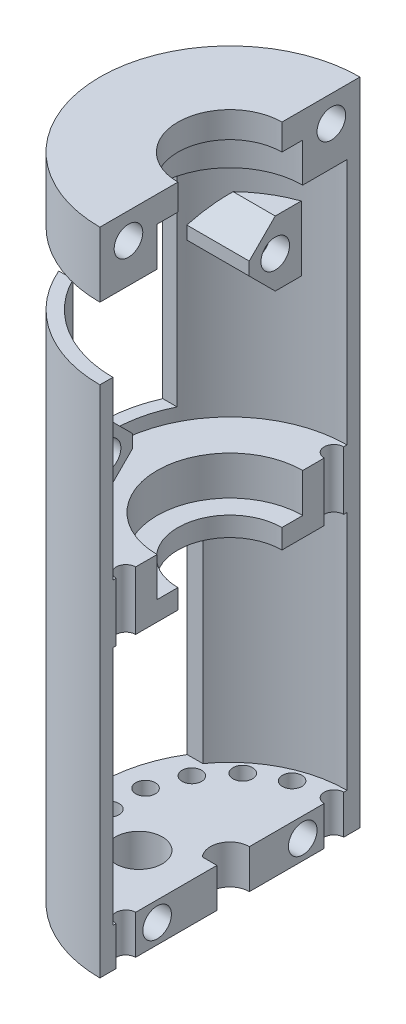
from build123d import *

# Parameters (mm, degrees)
SKETCH_1_R               = 10
EXTRUDE_1_DEPTH          = 3
CUT_EXTRUDE_1_REACH      = 16.457
SKETCH_2_R               = 0.75
SKETCH_3_R               = 10
SKETCH_3_R_2             = 9
EXTRUDE_2_DEPTH          = 47
CUT_EXTRUDE_START        = -50
CUT_EXTRUDE_2_DEPTH      = 50
EXTRUDE_3_DEPTH          = 5
SKETCH_6_R               = 1.1
CUT_EXTRUDE_3_DEPTH      = 1.5
EXTRUDE_START            = -5
EXTRUDE_4_DEPTH          = 5
SKETCH_8_R               = 1.1
CUT_EXTRUDE_4_DEPTH      = 1.5
EXTRUDE_START_2          = -23
EXTRUDE_5_DEPTH          = 3
EXTRUDE_START_3          = 1.5
EXTRUDE_6_DEPTH          = 1.5
EXTRUDE_START_4          = -2
EXTRUDE_7_DEPTH          = 2
EXTRUDE_START_5          = 3
EXTRUDE_8_DEPTH          = 3
CUT_EXTRUDE_5_REACH      = 31.597
SKETCH_13_R              = 0.75
CUT_EXTRUDE_6_REACH      = 53.962
CUT_EXTRUDE_6_END_RADIUS = 10
SKETCH_14_W              = 10.500045379
SKETCH_14_H              = 18.5
CUT_EXTRUDE_7_REACH      = 53.962
CUT_EXTRUDE_7_END_RADIUS = 10
SKETCH_16_R              = 1.1
CUT_EXTRUDE_8_DEPTH      = 3
CHAMFER_1_SIZE           = 2
CUT_EXTRUDE1_REACH       = 51.082
SKETCH1_R                = 1.8


with BuildPart() as part:
    # 草图1 → 凸台-拉伸1 (new body)
    with BuildSketch(Plane(origin=(0, 0, 0), x_dir=(1, 0, 0), z_dir=(0, 1, 0))):
        with Locations(Location((0, 0, 0), (0, 0, 270))):
            Circle(SKETCH_1_R)
        with BuildLine():
            Line((-1.118033989, -1), (1.118033989, -1))
            ThreePointArc((1.118033989, -1), (0, 1.5), (-1.118033989, -1))
        make_face(mode=Mode.SUBTRACT)
    extrude(amount=EXTRUDE_1_DEPTH)

    # 草图2 → 切除-拉伸1 (cut, up to next)
    with BuildSketch(Plane(origin=(0, 3, 0), x_dir=(1, 0, 0), z_dir=(0, 1, 0)), mode=Mode.PRIVATE) as cut_extrude_1_sk1:
        with Locations(Location((0, 8, 0), (0, 0, 270))):
            Circle(SKETCH_2_R)
    cut_extrude_1_tool1 = extrude(cut_extrude_1_sk1.sketch, amount=-CUT_EXTRUDE_1_REACH, mode=Mode.PRIVATE) & part.part
    # 草图2 → 切除-拉伸1 (cut, up to next)
    with BuildSketch(Plane(origin=(0, 3, 0), x_dir=(1, 0, 0), z_dir=(0, 1, 0)), mode=Mode.PRIVATE) as cut_extrude_1_sk2:
        with Locations(Location((2.736161147, 7.517540966, 0), (0, 0, 270))):
            Circle(SKETCH_2_R)
    cut_extrude_1_tool2 = extrude(cut_extrude_1_sk2.sketch, amount=-CUT_EXTRUDE_1_REACH, mode=Mode.PRIVATE) & part.part
    # 草图2 → 切除-拉伸1 (cut, up to next)
    with BuildSketch(Plane(origin=(0, 3, 0), x_dir=(1, 0, 0), z_dir=(0, 1, 0)), mode=Mode.PRIVATE) as cut_extrude_1_sk3:
        with Locations(Location((5.142300877, 6.128355545, 0), (0, 0, 270))):
            Circle(SKETCH_2_R)
    cut_extrude_1_tool3 = extrude(cut_extrude_1_sk3.sketch, amount=-CUT_EXTRUDE_1_REACH, mode=Mode.PRIVATE) & part.part
    # 草图2 → 切除-拉伸1 (cut, up to next)
    with BuildSketch(Plane(origin=(0, 3, 0), x_dir=(1, 0, 0), z_dir=(0, 1, 0)), mode=Mode.PRIVATE) as cut_extrude_1_sk4:
        with Locations(Location((6.92820323, 4, 0), (0, 0, 270))):
            Circle(SKETCH_2_R)
    cut_extrude_1_tool4 = extrude(cut_extrude_1_sk4.sketch, amount=-CUT_EXTRUDE_1_REACH, mode=Mode.PRIVATE) & part.part
    # 草图2 → 切除-拉伸1 (cut, up to next)
    with BuildSketch(Plane(origin=(0, 3, 0), x_dir=(1, 0, 0), z_dir=(0, 1, 0)), mode=Mode.PRIVATE) as cut_extrude_1_sk5:
        with Locations(Location((7.878462024, 1.389185421, 0), (0, 0, 270))):
            Circle(SKETCH_2_R)
    cut_extrude_1_tool5 = extrude(cut_extrude_1_sk5.sketch, amount=-CUT_EXTRUDE_1_REACH, mode=Mode.PRIVATE) & part.part
    # 草图2 → 切除-拉伸1 (cut, up to next)
    with BuildSketch(Plane(origin=(0, 3, 0), x_dir=(1, 0, 0), z_dir=(0, 1, 0)), mode=Mode.PRIVATE) as cut_extrude_1_sk6:
        with Locations(Location((7.878462024, -1.389185421, 0), (0, 0, 270))):
            Circle(SKETCH_2_R)
    cut_extrude_1_tool6 = extrude(cut_extrude_1_sk6.sketch, amount=-CUT_EXTRUDE_1_REACH, mode=Mode.PRIVATE) & part.part
    # 草图2 → 切除-拉伸1 (cut, up to next)
    with BuildSketch(Plane(origin=(0, 3, 0), x_dir=(1, 0, 0), z_dir=(0, 1, 0)), mode=Mode.PRIVATE) as cut_extrude_1_sk7:
        with Locations(Location((6.92820323, -4, 0), (0, 0, 270))):
            Circle(SKETCH_2_R)
    cut_extrude_1_tool7 = extrude(cut_extrude_1_sk7.sketch, amount=-CUT_EXTRUDE_1_REACH, mode=Mode.PRIVATE) & part.part
    # 草图2 → 切除-拉伸1 (cut, up to next)
    with BuildSketch(Plane(origin=(0, 3, 0), x_dir=(1, 0, 0), z_dir=(0, 1, 0)), mode=Mode.PRIVATE) as cut_extrude_1_sk8:
        with Locations(Location((5.142300877, -6.128355545, 0), (0, 0, 270))):
            Circle(SKETCH_2_R)
    cut_extrude_1_tool8 = extrude(cut_extrude_1_sk8.sketch, amount=-CUT_EXTRUDE_1_REACH, mode=Mode.PRIVATE) & part.part
    # 草图2 → 切除-拉伸1 (cut, up to next)
    with BuildSketch(Plane(origin=(0, 3, 0), x_dir=(1, 0, 0), z_dir=(0, 1, 0)), mode=Mode.PRIVATE) as cut_extrude_1_sk9:
        with Locations(Location((2.736161147, -7.517540966, 0), (0, 0, 270))):
            Circle(SKETCH_2_R)
    cut_extrude_1_tool9 = extrude(cut_extrude_1_sk9.sketch, amount=-CUT_EXTRUDE_1_REACH, mode=Mode.PRIVATE) & part.part
    # 草图2 → 切除-拉伸1 (cut, up to next)
    with BuildSketch(Plane(origin=(0, 3, 0), x_dir=(1, 0, 0), z_dir=(0, 1, 0)), mode=Mode.PRIVATE) as cut_extrude_1_sk10:
        with Locations(Location((0, -8, 0), (0, 0, 270))):
            Circle(SKETCH_2_R)
    cut_extrude_1_tool10 = extrude(cut_extrude_1_sk10.sketch, amount=-CUT_EXTRUDE_1_REACH, mode=Mode.PRIVATE) & part.part
    # 草图2 → 切除-拉伸1 (cut, up to next)
    with BuildSketch(Plane(origin=(0, 3, 0), x_dir=(1, 0, 0), z_dir=(0, 1, 0)), mode=Mode.PRIVATE) as cut_extrude_1_sk11:
        with Locations(Location((-2.736161147, -7.517540966, 0), (0, 0, 270))):
            Circle(SKETCH_2_R)
    cut_extrude_1_tool11 = extrude(cut_extrude_1_sk11.sketch, amount=-CUT_EXTRUDE_1_REACH, mode=Mode.PRIVATE) & part.part
    # 草图2 → 切除-拉伸1 (cut, up to next)
    with BuildSketch(Plane(origin=(0, 3, 0), x_dir=(1, 0, 0), z_dir=(0, 1, 0)), mode=Mode.PRIVATE) as cut_extrude_1_sk12:
        with Locations(Location((-5.142300877, -6.128355545, 0), (0, 0, 270))):
            Circle(SKETCH_2_R)
    cut_extrude_1_tool12 = extrude(cut_extrude_1_sk12.sketch, amount=-CUT_EXTRUDE_1_REACH, mode=Mode.PRIVATE) & part.part
    # 草图2 → 切除-拉伸1 (cut, up to next)
    with BuildSketch(Plane(origin=(0, 3, 0), x_dir=(1, 0, 0), z_dir=(0, 1, 0)), mode=Mode.PRIVATE) as cut_extrude_1_sk13:
        with Locations(Location((-6.92820323, -4, 0), (0, 0, 270))):
            Circle(SKETCH_2_R)
    cut_extrude_1_tool13 = extrude(cut_extrude_1_sk13.sketch, amount=-CUT_EXTRUDE_1_REACH, mode=Mode.PRIVATE) & part.part
    # 草图2 → 切除-拉伸1 (cut, up to next)
    with BuildSketch(Plane(origin=(0, 3, 0), x_dir=(1, 0, 0), z_dir=(0, 1, 0)), mode=Mode.PRIVATE) as cut_extrude_1_sk14:
        with Locations(Location((-7.878462024, -1.389185421, 0), (0, 0, 270))):
            Circle(SKETCH_2_R)
    cut_extrude_1_tool14 = extrude(cut_extrude_1_sk14.sketch, amount=-CUT_EXTRUDE_1_REACH, mode=Mode.PRIVATE) & part.part
    # 草图2 → 切除-拉伸1 (cut, up to next)
    with BuildSketch(Plane(origin=(0, 3, 0), x_dir=(1, 0, 0), z_dir=(0, 1, 0)), mode=Mode.PRIVATE) as cut_extrude_1_sk15:
        with Locations(Location((-7.878462024, 1.389185421, 0), (0, 0, 270))):
            Circle(SKETCH_2_R)
    cut_extrude_1_tool15 = extrude(cut_extrude_1_sk15.sketch, amount=-CUT_EXTRUDE_1_REACH, mode=Mode.PRIVATE) & part.part
    # 草图2 → 切除-拉伸1 (cut, up to next)
    with BuildSketch(Plane(origin=(0, 3, 0), x_dir=(1, 0, 0), z_dir=(0, 1, 0)), mode=Mode.PRIVATE) as cut_extrude_1_sk16:
        with Locations(Location((-6.92820323, 4, 0), (0, 0, 270))):
            Circle(SKETCH_2_R)
    cut_extrude_1_tool16 = extrude(cut_extrude_1_sk16.sketch, amount=-CUT_EXTRUDE_1_REACH, mode=Mode.PRIVATE) & part.part
    # 草图2 → 切除-拉伸1 (cut, up to next)
    with BuildSketch(Plane(origin=(0, 3, 0), x_dir=(1, 0, 0), z_dir=(0, 1, 0)), mode=Mode.PRIVATE) as cut_extrude_1_sk17:
        with Locations(Location((-5.142300877, 6.128355545, 0), (0, 0, 270))):
            Circle(SKETCH_2_R)
    cut_extrude_1_tool17 = extrude(cut_extrude_1_sk17.sketch, amount=-CUT_EXTRUDE_1_REACH, mode=Mode.PRIVATE) & part.part
    # 草图2 → 切除-拉伸1 (cut, up to next)
    with BuildSketch(Plane(origin=(0, 3, 0), x_dir=(1, 0, 0), z_dir=(0, 1, 0)), mode=Mode.PRIVATE) as cut_extrude_1_sk18:
        with Locations(Location((-2.736161147, 7.517540966, 0), (0, 0, 270))):
            Circle(SKETCH_2_R)
    cut_extrude_1_tool18 = extrude(cut_extrude_1_sk18.sketch, amount=-CUT_EXTRUDE_1_REACH, mode=Mode.PRIVATE) & part.part
    add(cut_extrude_1_tool1.solids().sort_by_distance((0, 3, -8))[0], mode=Mode.SUBTRACT)
    add(cut_extrude_1_tool2.solids().sort_by_distance((2.736161, 3, -7.517541))[0], mode=Mode.SUBTRACT)
    add(cut_extrude_1_tool3.solids().sort_by_distance((5.142301, 3, -6.128356))[0], mode=Mode.SUBTRACT)
    add(cut_extrude_1_tool4.solids().sort_by_distance((6.928203, 3, -4))[0], mode=Mode.SUBTRACT)
    add(cut_extrude_1_tool5.solids().sort_by_distance((7.878462, 3, -1.389185))[0], mode=Mode.SUBTRACT)
    add(cut_extrude_1_tool6.solids().sort_by_distance((7.878462, 3, 1.389185))[0], mode=Mode.SUBTRACT)
    add(cut_extrude_1_tool7.solids().sort_by_distance((6.928203, 3, 4))[0], mode=Mode.SUBTRACT)
    add(cut_extrude_1_tool8.solids().sort_by_distance((5.142301, 3, 6.128356))[0], mode=Mode.SUBTRACT)
    add(cut_extrude_1_tool9.solids().sort_by_distance((2.736161, 3, 7.517541))[0], mode=Mode.SUBTRACT)
    add(cut_extrude_1_tool10.solids().sort_by_distance((0, 3, 8))[0], mode=Mode.SUBTRACT)
    add(cut_extrude_1_tool11.solids().sort_by_distance((-2.736161, 3, 7.517541))[0], mode=Mode.SUBTRACT)
    add(cut_extrude_1_tool12.solids().sort_by_distance((-5.142301, 3, 6.128356))[0], mode=Mode.SUBTRACT)
    add(cut_extrude_1_tool13.solids().sort_by_distance((-6.928203, 3, 4))[0], mode=Mode.SUBTRACT)
    add(cut_extrude_1_tool14.solids().sort_by_distance((-7.878462, 3, 1.389185))[0], mode=Mode.SUBTRACT)
    add(cut_extrude_1_tool15.solids().sort_by_distance((-7.878462, 3, -1.389185))[0], mode=Mode.SUBTRACT)
    add(cut_extrude_1_tool16.solids().sort_by_distance((-6.928203, 3, -4))[0], mode=Mode.SUBTRACT)
    add(cut_extrude_1_tool17.solids().sort_by_distance((-5.142301, 3, -6.128356))[0], mode=Mode.SUBTRACT)
    add(cut_extrude_1_tool18.solids().sort_by_distance((-2.736161, 3, -7.517541))[0], mode=Mode.SUBTRACT)

    # 草图3 → 凸台-拉伸2 (add)
    with BuildSketch(Plane(origin=(0, 3, 0), x_dir=(1, 0, 0), z_dir=(0, 1, 0))):
        with Locations(Location((0, 0, 0), (0, 0, 270))):
            Circle(SKETCH_3_R)
        with Locations(Location((0, 0, 0), (0, 0, 270))):
            Circle(SKETCH_3_R_2, mode=Mode.SUBTRACT)
    extrude(amount=EXTRUDE_2_DEPTH)

    # 草图4 → 切除-拉伸2 (cut)
    with BuildSketch(Plane(origin=(0, 50, 0), x_dir=(1, 0, 0), z_dir=(0, 1, 0)).offset(CUT_EXTRUDE_START)):
        with BuildLine():
            Line((0, -10), (0, 10))
            ThreePointArc((0, 10), (10, 0), (0, -10))
        make_face()
    extrude(amount=CUT_EXTRUDE_2_DEPTH, mode=Mode.SUBTRACT)

    # 草图5 → 凸台-拉伸3 (add)
    with BuildSketch(Plane(origin=(0, 29, 0), x_dir=(1, 0, 0), z_dir=(0, 1, 0))):
        with BuildLine():
            Line((-3, -8.485281374), (-3, -4.485281374))
            Line((-3, -4.485281374), (-7.802707927, -4.485281374))
            ThreePointArc((-7.802707927, -4.485281374), (-5.759741716, -6.9155893), (-3, -8.485281374))
        make_face()
    extrude(amount=EXTRUDE_3_DEPTH)

    # 草图6 → 切除-拉伸3 (cut)
    with BuildSketch(Plane(origin=(-3, 0, 0), x_dir=(0, 0, -1), z_dir=(1, 0, 0))):
        with Locations((-6.485281374, 31.5)):
            Circle(SKETCH_6_R)
    extrude(amount=-CUT_EXTRUDE_3_DEPTH, mode=Mode.SUBTRACT)

    # 草图7 → 凸台-拉伸4 (add)
    with BuildSketch(Plane(origin=(0, 41, 0), x_dir=(1, 0, 0), z_dir=(0, 1, 0)).offset(EXTRUDE_START)):
        with BuildLine():
            Line((-3, 8.485281374), (-3, 4.485281374))
            Line((-3, 4.485281374), (-7.802707927, 4.485281374))
            ThreePointArc((-7.802707927, 4.485281374), (-5.759741716, 6.9155893), (-3, 8.485281374))
        make_face()
    extrude(amount=EXTRUDE_4_DEPTH)

    # 草图8 → 切除-拉伸4 (cut)
    with BuildSketch(Plane(origin=(-3, 0, 0), x_dir=(0, 0, -1), z_dir=(1, 0, 0))):
        with Locations((6.485281374, 38.5)):
            Circle(SKETCH_8_R)
    extrude(amount=-CUT_EXTRUDE_4_DEPTH, mode=Mode.SUBTRACT)

    # 草图9 → 凸台-拉伸5 (add)
    with BuildSketch(Plane.XZ.offset(EXTRUDE_START_2)):
        with BuildLine():
            Line((0, 9), (0, 5.6))
            ThreePointArc((0, 5.6), (-5.6, 0), (0, -5.6))
            Line((0, -5.6), (0, -9))
            ThreePointArc((0, -9), (-9, 0), (0, 9))
        make_face()
    extrude(amount=-EXTRUDE_5_DEPTH)

    # 草图10 → 凸台-拉伸6 (add)
    with BuildSketch(Plane.XZ.offset(-23).offset(EXTRUDE_START_3)):
        with BuildLine():
            Line((0, 9), (0, 4))
            ThreePointArc((0, 4), (-4, 0), (0, -4))
            Line((0, -4), (0, -9))
            ThreePointArc((0, -9), (-9, 0), (0, 9))
        make_face()
    extrude(amount=-EXTRUDE_6_DEPTH)

    # 草图11 → 凸台-拉伸7 (add)
    with BuildSketch(Plane(origin=(0, 50, 0), x_dir=(1, 0, 0), z_dir=(0, 1, 0)).offset(EXTRUDE_START_4)):
        with BuildLine():
            Line((0, -9), (0, -4))
            ThreePointArc((0, -4), (-4, 0), (0, 4))
            Line((0, 4), (0, 9))
            ThreePointArc((0, 9), (-9, 0), (0, -9))
        make_face()
    extrude(amount=EXTRUDE_7_DEPTH)

    # 草图12 → 凸台-拉伸8 (add)
    with BuildSketch(Plane.XZ.offset(-48).offset(EXTRUDE_START_5)):
        with BuildLine():
            Line((0, 9), (0, 5.6))
            ThreePointArc((0, 5.6), (-5.6, 0), (0, -5.6))
            Line((0, -5.6), (0, -9))
            ThreePointArc((0, -9), (-9, 0), (0, 9))
        make_face()
    extrude(amount=-EXTRUDE_8_DEPTH)

    # 草图13 → 切除-拉伸5 (cut, up to next)
    with BuildSketch(Plane(origin=(0, 26, 0), x_dir=(1, 0, 0), z_dir=(0, 1, 0)), mode=Mode.PRIVATE) as cut_extrude_5_sk1:
        with Locations((0, 8)):
            Circle(SKETCH_13_R)
    cut_extrude_5_tool1 = extrude(cut_extrude_5_sk1.sketch, amount=-CUT_EXTRUDE_5_REACH, mode=Mode.PRIVATE) & part.part
    # 草图13 → 切除-拉伸5 (cut, up to next)
    with BuildSketch(Plane(origin=(0, 26, 0), x_dir=(1, 0, 0), z_dir=(0, 1, 0)), mode=Mode.PRIVATE) as cut_extrude_5_sk2:
        with Locations((0, -8)):
            Circle(SKETCH_13_R)
    cut_extrude_5_tool2 = extrude(cut_extrude_5_sk2.sketch, amount=-CUT_EXTRUDE_5_REACH, mode=Mode.PRIVATE) & part.part
    add(cut_extrude_5_tool1.solids().sort_by_distance((0, 26, -8))[0], mode=Mode.SUBTRACT)
    add(cut_extrude_5_tool2.solids().sort_by_distance((0, 26, 8))[0], mode=Mode.SUBTRACT)

    # 切除-拉伸6: up to this cylinder (the profile starts inside it)
    cut_extrude_6_end = Plane(origin=(0, 12.25, 0), z_dir=(0, -1, 0)) * Cylinder(CUT_EXTRUDE_6_END_RADIUS, 128.924, mode=Mode.PRIVATE)
    # 草图14 → 切除-拉伸6 (cut, up to the surface)
    with BuildSketch(Plane(origin=(0, 0, 0), x_dir=(0, 0, -1), z_dir=(1, 0, 0)), mode=Mode.PRIVATE) as cut_extrude_6_sk1:
        with Locations((-0.013848658, 12.25)):
            Rectangle(SKETCH_14_W, SKETCH_14_H)
    cut_extrude_6_tool1 = extrude(cut_extrude_6_sk1.sketch, amount=-CUT_EXTRUDE_6_REACH, mode=Mode.PRIVATE) & cut_extrude_6_end
    add(cut_extrude_6_tool1.solids().sort_by_distance((0, 12.25, 0.013849))[0], mode=Mode.SUBTRACT)

    # 切除-拉伸7: up to this cylinder (the profile starts inside it)
    cut_extrude_7_end = Plane(origin=(0, 37.165254, 0), z_dir=(0, -1, 0)) * Cylinder(CUT_EXTRUDE_7_END_RADIUS, 128.924, mode=Mode.PRIVATE)
    # 草图15 → 切除-拉伸7 (cut, up to the surface)
    with BuildSketch(Plane(origin=(0, 0, 0), x_dir=(0, 0, -1), z_dir=(1, 0, 0)), mode=Mode.PRIVATE) as cut_extrude_7_sk1:
        Polygon((-3.637254074, 45), (-10, 45), (-10, 39.5), (-4, 39.5), (-4, 27), (4, 27), (4, 45), align=None)
    cut_extrude_7_tool1 = extrude(cut_extrude_7_sk1.sketch, amount=-CUT_EXTRUDE_7_REACH, mode=Mode.PRIVATE) & cut_extrude_7_end
    add(cut_extrude_7_tool1.solids().sort_by_distance((0, 37.165254, 1.305085))[0], mode=Mode.SUBTRACT)

    # 草图16 → 切除-拉伸8 (cut)
    with BuildSketch(Plane(origin=(0, 0, 0), x_dir=(0, 0, -1), z_dir=(1, 0, 0))):
        with Locations((-7.8, 48)):
            Circle(SKETCH_16_R)
        with Locations((7.8, 48)):
            Circle(SKETCH_16_R)
        with Locations((-5.6, 1.5)):
            Circle(SKETCH_16_R)
        with Locations((5.6, 1.5)):
            Circle(SKETCH_16_R)
    extrude(amount=-CUT_EXTRUDE_8_DEPTH, mode=Mode.SUBTRACT)

    # 倒角1
    chamfer_1_edges = [part.edges().sort_by_distance(p)[0] for p in [
        (-5.401353963, 29, 4.485281374),
        (-5.401353963, 34, 4.485281374),
        (-5.401353963, 36, -4.485281374),
        (-5.401353963, 41, -4.485281374),
    ]]
    chamfer(chamfer_1_edges, length=CHAMFER_1_SIZE)

    # Sketch1 → Cut-Extrude1 (cut, up to next)
    with BuildSketch(Plane(origin=(0, 3, 0), x_dir=(1, 0, 0), z_dir=(0, 1, 0)), mode=Mode.PRIVATE) as cut_extrude1_sk1:
        with Locations(Location((-4, -3, 0), (0, 0, 270))):
            Circle(SKETCH1_R)
    cut_extrude1_tool1 = extrude(cut_extrude1_sk1.sketch, amount=-CUT_EXTRUDE1_REACH, mode=Mode.PRIVATE) & part.part
    add(cut_extrude1_tool1.solids().sort_by_distance((-4, 3, 3))[0], mode=Mode.SUBTRACT)


solid = part.part
